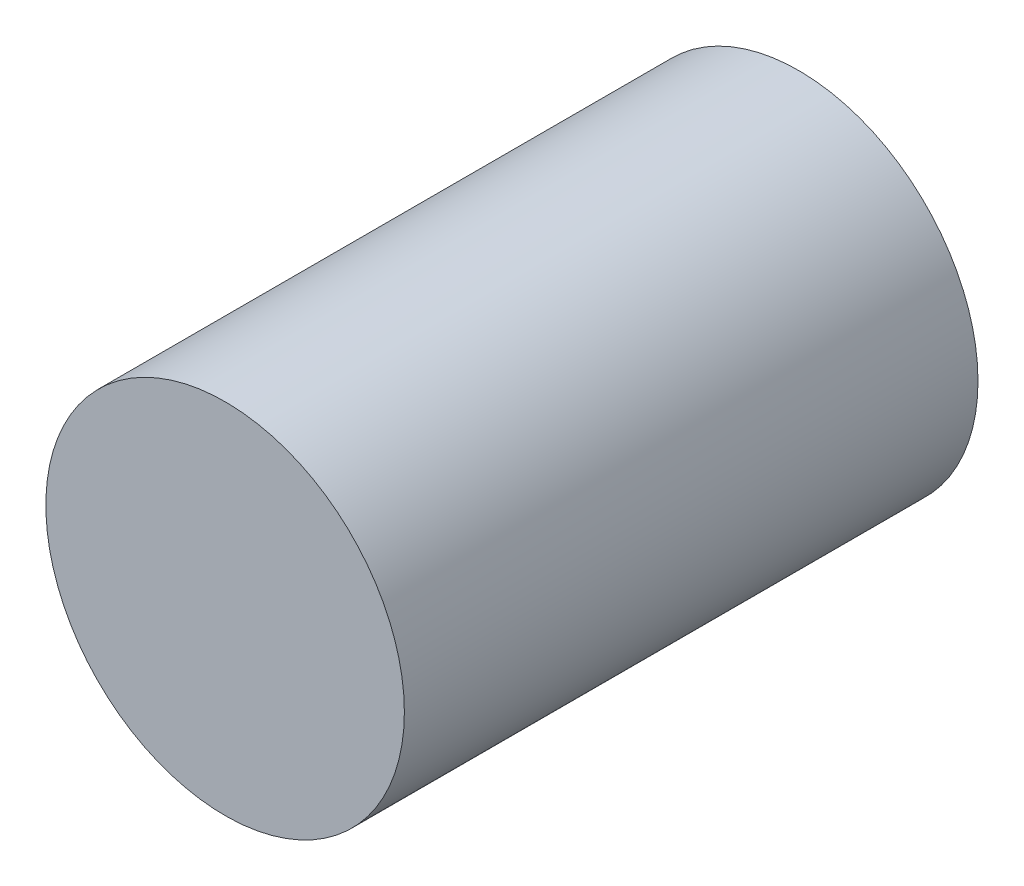
from build123d import *

# Parameters (mm, degrees)
SKETCH1_R           = 2.5
BOSS_EXTRUDE1_DEPTH = 8


with BuildPart() as part:
    # Sketch1 → Boss-Extrude1 (new body)
    with BuildSketch(Plane.XY):
        Circle(SKETCH1_R)
    extrude(amount=BOSS_EXTRUDE1_DEPTH)


solid = part.part
